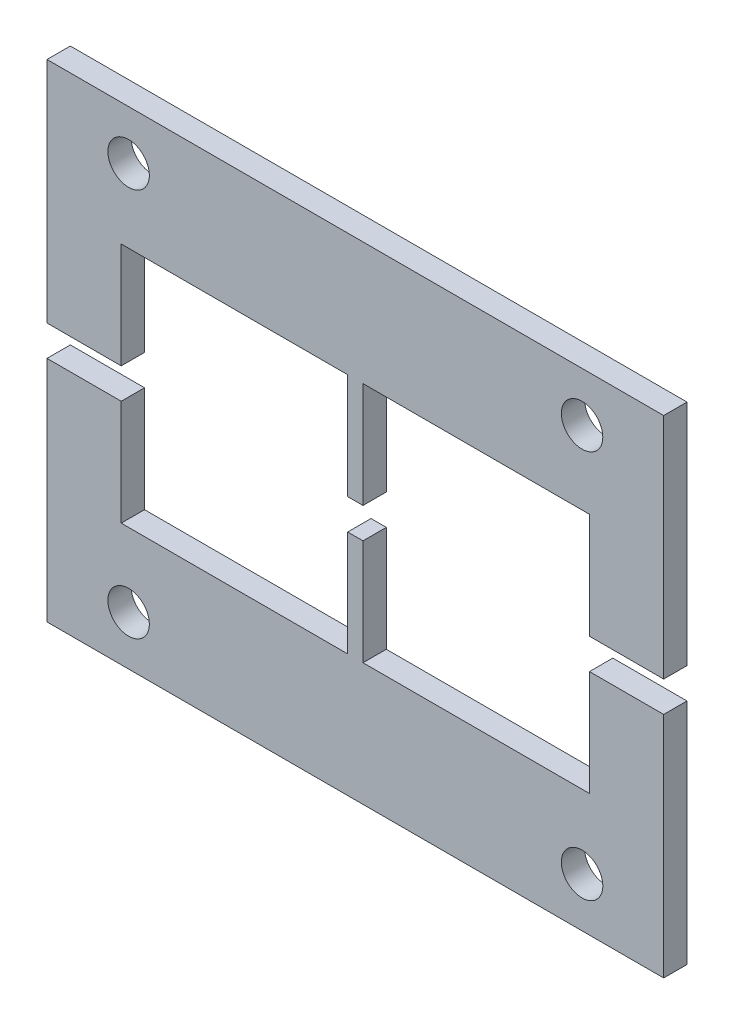
from build123d import *

# Parameters (mm, degrees)
SKETCH1_R             = 2.032
BOSS_EXTRUDE1_DEPTH   = 2.286
BOSS_EXTRUDE1_2_DEPTH = 2.286


with BuildPart() as part:
    # Sketch1 → Boss-Extrude1 (new body)
    with BuildSketch(Plane.XY):
        Polygon((-30.226, 23.876), (30.226, 23.876), (30.226, 1.5), (22.95, 1.5), (22.95, 11.85), (0.75, 11.85), (0.75, 1.5), (-0.75, 1.5), (-0.75, 11.85), (-22.95, 11.85), (-22.95, 1.5), (-30.226, 1.5), align=None)
        with Locations((22.225, 19.05)):
            Circle(SKETCH1_R, mode=Mode.SUBTRACT)
        with Locations(Location((-22.225, 19.05, 0), (0, 0, 180))):
            Circle(SKETCH1_R, mode=Mode.SUBTRACT)
    extrude(amount=BOSS_EXTRUDE1_DEPTH)


with BuildPart() as body_2:
    # Sketch1 → Boss-Extrude1 2 (new body)
    with BuildSketch(Plane.XY):
        Polygon((22.95, -1.5), (30.226, -1.5), (30.226, -23.876), (-30.226, -23.876), (-30.226, -1.5), (-22.95, -1.5), (-22.95, -11.85), (-0.75, -11.85), (-0.75, -1.5), (0.75, -1.5), (0.75, -11.85), (22.95, -11.85), align=None)
        with Locations(Location((22.225, -19.05, 0), (0, 0, 180))):
            Circle(SKETCH1_R, mode=Mode.SUBTRACT)
        with Locations((-22.225, -19.05)):
            Circle(SKETCH1_R, mode=Mode.SUBTRACT)
    extrude(amount=BOSS_EXTRUDE1_2_DEPTH)


solid = Compound([part.part, body_2.part])
